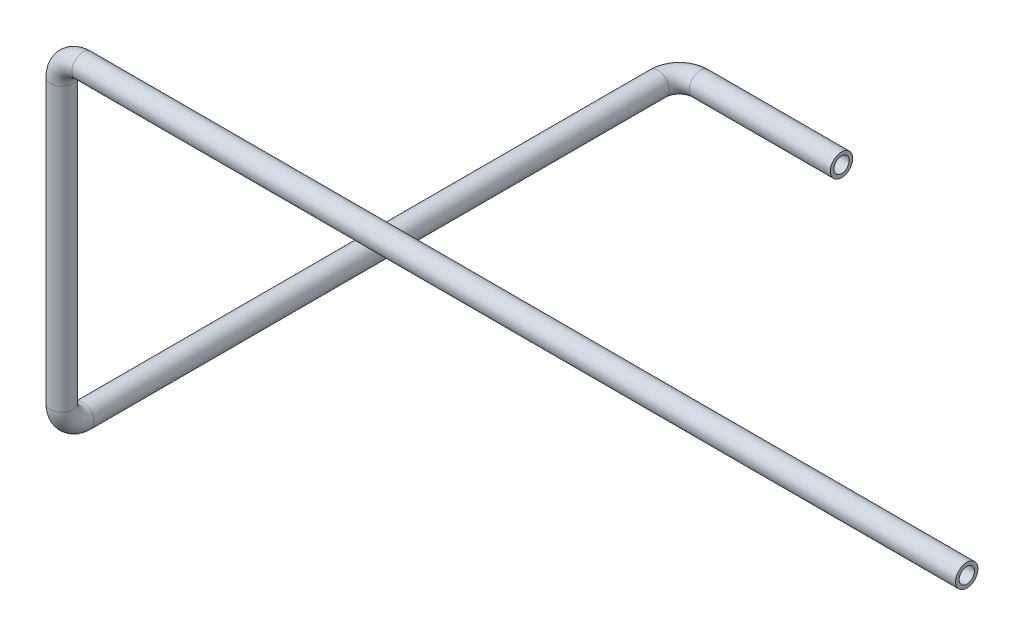
from build123d import *

# Parameters (mm, degrees)
TUBE_PROFILE_R   = 3.175
TUBE_PROFILE_R_2 = 2.175


with BuildPart() as part:
    # Tube: sweep along a curve in space
    with BuildLine() as tube_path:
        Line((76.5, 326, 225), (-174, 326, 225))
        ThreePointArc((-180, 320, 225), (-178.242640687, 324.242640687, 225), (-174, 326, 225))
        Line((-180, 320, 225), (-180, 240, 225))
        ThreePointArc((-180, 234, 219), (-180, 235.757359313, 223.242640687), (-180, 240, 225))
        Line((-180, 234, 219), (-180, 234, 56))
        ThreePointArc((-174, 234, 50), (-178.242640687, 234, 51.757359313), (-180, 234, 56))
        Line((-174, 234, 50), (-134, 234, 50))
    # Tube profile (on start of the path) → Tube (sweep)
    with BuildSketch(Plane(origin=(76.5, 326, 225), x_dir=(0, 0, -1), z_dir=(-1, 0, 0))):
        Circle(TUBE_PROFILE_R)
        Circle(TUBE_PROFILE_R_2, mode=Mode.SUBTRACT)
    sweep(path=tube_path.line)


solid = part.part
